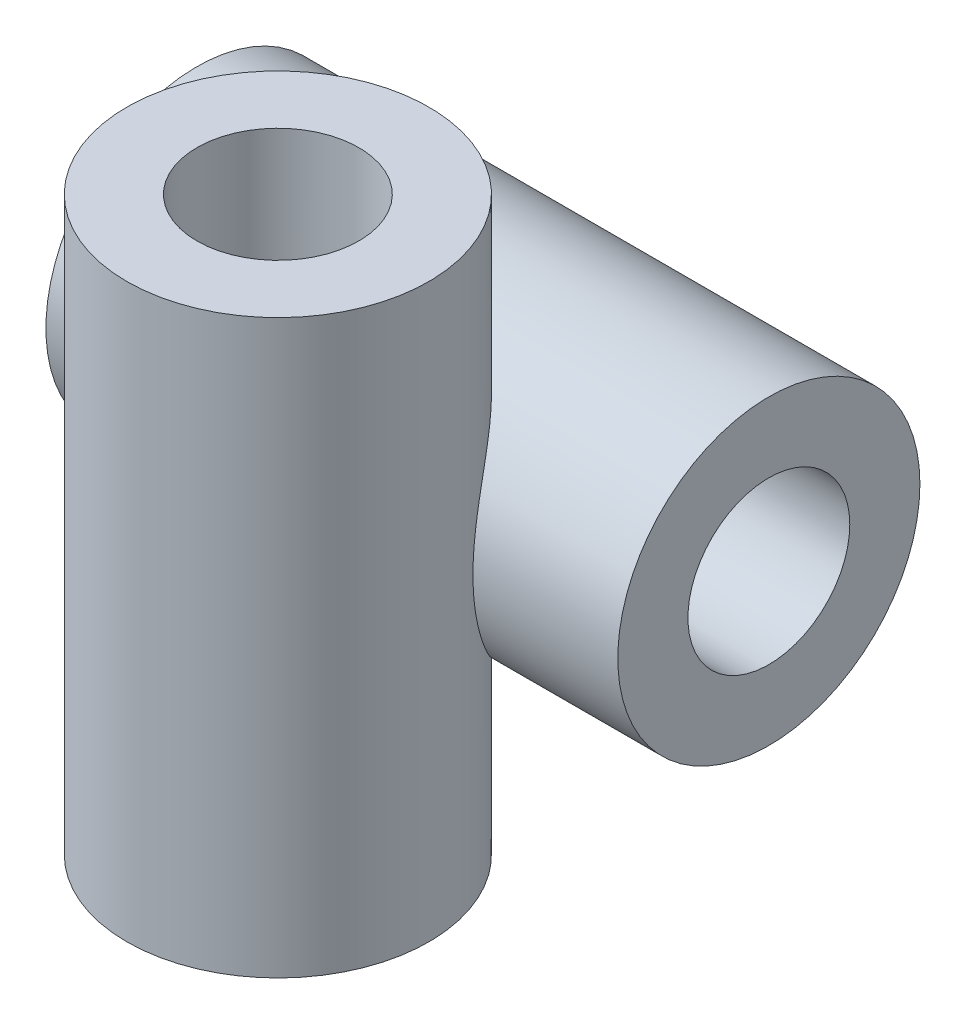
from build123d import *

# Parameters (mm, degrees)
SKETCH1_R           = 28
SKETCH1_R_2         = 15
BOSS_EXTRUDE1_DEPTH = 106
SKETCH4_R           = 28
SKETCH4_R_2         = 15
BOSS_EXTRUDE2_DEPTH = 53
CUT_EXTRUDE2_START  = -106
SKETCH5_R           = 15
CUT_EXTRUDE2_DEPTH  = 106
SCALE1_SCALE        = 0.33


with BuildPart() as part:
    # Sketch1 → Boss-Extrude1 (new body)
    with BuildSketch(Plane(origin=(0, 0, 0), x_dir=(1, 0, 0), z_dir=(0, 1, 0))):
        with Locations(Location((0, 0, 0), (0, 0, 270))):
            Circle(SKETCH1_R)
        with Locations(Location((0, 0, 0), (0, 0, 270))):
            Circle(SKETCH1_R_2, mode=Mode.SUBTRACT)
    extrude(amount=BOSS_EXTRUDE1_DEPTH)

    # Sketch4 → Boss-Extrude2 (add, symmetric)
    with BuildSketch(Plane(origin=(0, 0, 0), x_dir=(0, 0, -1), z_dir=(1, 0, 0))):
        with Locations((38, 53)):
            Circle(SKETCH4_R)
        with Locations((38, 53)):
            Circle(SKETCH4_R_2, mode=Mode.SUBTRACT)
    extrude(amount=BOSS_EXTRUDE2_DEPTH, both=True)

    # Sketch5 → Cut-Extrude2 (cut)
    with BuildSketch(Plane(origin=(53, 0, 0), x_dir=(0, 0, -1), z_dir=(1, 0, 0)).offset(CUT_EXTRUDE2_START)):
        with Locations((38, 53)):
            Circle(SKETCH5_R)
    extrude(amount=CUT_EXTRUDE2_DEPTH, mode=Mode.SUBTRACT)


with BuildPart() as part_1:
    # Scale1: scaled about (-6.4e-07, 52.999995481, -18.972102588)
    add(part.part.scale(SCALE1_SCALE).moved(Location((-4.29e-07, 35.509996972, -12.711308734))))


solid = part_1.part
